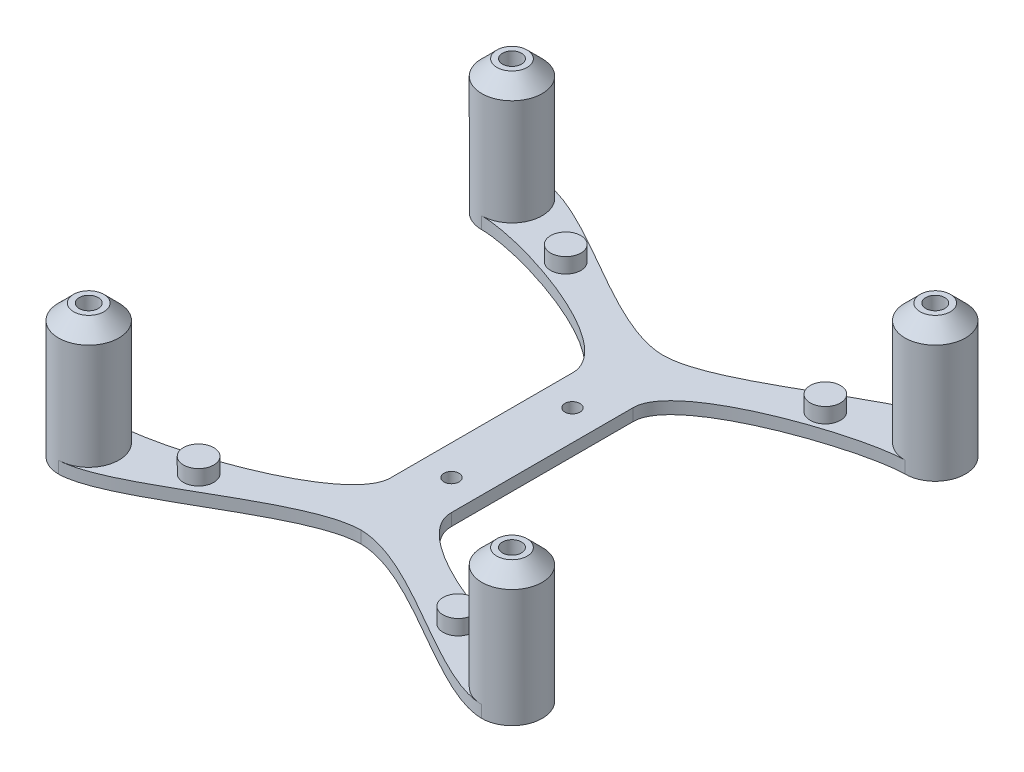
from build123d import *

# Parameters (mm, degrees)
BOSS_EXTRUDE1_DEPTH                        = 2.54
SKETCH2_R                                  = 6.350000000000003
BOSS_EXTRUDE2_DEPTH                        = 25.4
MIRROR1_AT_THE_SECOND_PLANE_COPY_1_DEPTH   = 2.54
MIRROR1_AT_THE_SECOND_PLANE_COPY_2_SKETC_R = 6.350000000000003
MIRROR1_AT_THE_SECOND_PLANE_COPY_2_DEPTH   = 25.4
CHAMFER1_SIZE                              = 3.175
SKETCH3_R                                  = 1.5875000000000001
CUT_EXTRUDE1_DEPTH                         = 77.20000013333332
SKETCH4_R                                  = 2.0000000000000036
CUT_EXTRUDE2_DEPTH                         = 4.8
SKETCH5_R                                  = 1.5999999999999974
CUT_EXTRUDE3_DEPTH                         = 76.47674890287736
MIRROR2_AT_THE_SECOND_PLANE_COPY_1_SKETC_R = 2.0000000000000036
MIRROR2_AT_THE_SECOND_PLANE_COPY_1_DEPTH   = 4.8
MIRROR2_AT_THE_SECOND_PLANE_COPY_2_SKETC_R = 1.5999999999999974
MIRROR2_AT_THE_SECOND_PLANE_COPY_2_DEPTH   = 76.47674890287736
SKETCH6_R                                  = 3.1750000000000003
BOSS_EXTRUDE3_DEPTH                        = 3.175
MIRROR3_AT_THE_SECOND_PLANE_COPY_1_SKETC_R = 3.1750000000000003
MIRROR3_AT_THE_SECOND_PLANE_COPY_1_DEPTH   = 3.175


with BuildPart() as part:
    # Sketch1 → Boss-Extrude1 (new body)
    with BuildSketch(Plane(origin=(0, 0, 0), x_dir=(1, 0, 0), z_dir=(0, 1, 0))):
        with BuildLine():
            Line((-6.35, -7.8e-16), (0, 0))
            Line((0, 0), (0, 31.75))
            add(Edge.make_bspline(
                [(0, 31.75), (-11.810067101614626, 31.826488984199244), (-33.56352785361864, 50.29624659174145), (-44.09723296316762, 50.79019364197376)],
                knots=[0, 0, 0, 0, 0.9888261705717568, 0.9888261705717568, 0.9888261705717568, 0.9888261705717568], degree=3))
            ThreePointArc((-44.09723296316761, 50.79019364197375), (-39.836835647633734, 48.81362402803646), (-38.099999999999994, 44.44999999999999))
            ThreePointArc((-38.099999999999994, 44.44999999999999), (-39.959871939465415, 39.95987193946541), (-44.449999999999996, 38.09999999999999))
            add(Edge.make_bspline(
                [(-6.35, 19.05), (-6.175250797111612, 28.394037165914764), (-35.10270017916649, 38.03721238456326), (-44.449999999999996, 38.09999999999999)],
                knots=[0, 0, 0, 0, 1, 1, 1, 1], degree=3))
            Line((-6.35, 19.05), (-6.35, -7.8e-16))
        make_face()
        with BuildLine():
            add(Edge.make_bspline(
                [(-44.09723296316762, 50.79019364197376), (-44.216264829075314, 50.79577529044761), (-44.333864020357055, 50.79906156917483), (-44.45000000000001, 50.79999999999999)],
                knots=[0.9888261705717568, 0.9888261705717568, 0.9888261705717568, 0.9888261705717568, 1, 1, 1, 1], degree=3))
            ThreePointArc((-44.09723296316761, 50.79019364197375), (-44.27354834448691, 50.79754793705936), (-44.45000000000001, 50.79999999999999))
        make_face()
        with BuildLine():
            ThreePointArc((-38.099999999999994, 44.44999999999999), (-39.836835647633734, 48.81362402803646), (-44.09723296316761, 50.79019364197375))
            add(Edge.make_bspline(
                [(-44.09723296316762, 50.79019364197376), (-44.216264829075314, 50.79577529044761), (-44.333864020357055, 50.79906156917483), (-44.45000000000001, 50.79999999999999)],
                knots=[0.9888261705717568, 0.9888261705717568, 0.9888261705717568, 0.9888261705717568, 1, 1, 1, 1], degree=3))
            ThreePointArc((-44.45000000000001, 50.79999999999999), (-50.8, 44.44999999999998), (-44.449999999999996, 38.09999999999999))
            ThreePointArc((-44.449999999999996, 38.09999999999999), (-39.959871939465415, 39.95987193946541), (-38.099999999999994, 44.44999999999999))
        make_face()
    boss_extrude1 = extrude(amount=BOSS_EXTRUDE1_DEPTH)

    # Sketch2 → Boss-Extrude2 (add)
    with BuildSketch(Plane(origin=(0, 2.54, 0), x_dir=(1, 0, 0), z_dir=(0, 1, 0))):
        with Locations(Location((-44.449999999999996, 44.44999999999999, 0), (0, 0, 270))):
            Circle(SKETCH2_R)
    boss_extrude2 = extrude(amount=BOSS_EXTRUDE2_DEPTH)

    # Mirror1: Boss-Extrude1, Boss-Extrude2 across plane
    add(boss_extrude1.mirror(Plane(origin=(0, 0, 0), x_dir=(0, 0, 1), z_dir=(1, 0, 0))))
    add(boss_extrude2.mirror(Plane(origin=(0, 0, 0), x_dir=(0, 0, 1), z_dir=(1, 0, 0))))

    # Mirror1 at the second plane: Boss-Extrude1, Boss-Extrude2 across plane
    add(boss_extrude1.mirror(Plane.XY))
    add(boss_extrude2.mirror(Plane.XY))

    # Mirror1 at the second plane copy 1 sketc → Mirror1 at the second plane copy 1 (add)
    with BuildSketch(Plane(origin=(0, 0, 0), x_dir=(-1, 0, 0), z_dir=(0, 1, 0))):
        with BuildLine():
            Line((-6.35, -7.8e-16), (0, 0))
            Line((0, 0), (0, 31.75))
            add(Edge.make_bspline(
                [(0, 31.75), (-11.810067101614626, 31.826488984199244), (-33.56352785361864, 50.29624659174145), (-44.09723296316762, 50.79019364197376)],
                knots=[0, 0, 0, 0, 0.9888261705717568, 0.9888261705717568, 0.9888261705717568, 0.9888261705717568], degree=3))
            ThreePointArc((-44.09723296316761, 50.79019364197375), (-39.836835647633734, 48.81362402803646), (-38.099999999999994, 44.44999999999999))
            ThreePointArc((-38.099999999999994, 44.44999999999999), (-39.959871939465415, 39.95987193946541), (-44.449999999999996, 38.09999999999999))
            add(Edge.make_bspline(
                [(-6.35, 19.05), (-6.175250797111612, 28.394037165914764), (-35.10270017916649, 38.03721238456326), (-44.449999999999996, 38.09999999999999)],
                knots=[0, 0, 0, 0, 1, 1, 1, 1], degree=3))
            Line((-6.35, 19.05), (-6.35, -7.8e-16))
        make_face()
        with BuildLine():
            add(Edge.make_bspline(
                [(-44.09723296316762, 50.79019364197376), (-44.216264829075314, 50.79577529044761), (-44.333864020357055, 50.79906156917483), (-44.45000000000001, 50.79999999999999)],
                knots=[0.9888261705717568, 0.9888261705717568, 0.9888261705717568, 0.9888261705717568, 1, 1, 1, 1], degree=3))
            ThreePointArc((-44.09723296316761, 50.79019364197375), (-44.27354834448691, 50.79754793705936), (-44.45000000000001, 50.79999999999999))
        make_face()
        with BuildLine():
            ThreePointArc((-38.099999999999994, 44.44999999999999), (-39.836835647633734, 48.81362402803646), (-44.09723296316761, 50.79019364197375))
            add(Edge.make_bspline(
                [(-44.09723296316762, 50.79019364197376), (-44.216264829075314, 50.79577529044761), (-44.333864020357055, 50.79906156917483), (-44.45000000000001, 50.79999999999999)],
                knots=[0.9888261705717568, 0.9888261705717568, 0.9888261705717568, 0.9888261705717568, 1, 1, 1, 1], degree=3))
            ThreePointArc((-44.45000000000001, 50.79999999999999), (-50.8, 44.44999999999998), (-44.449999999999996, 38.09999999999999))
            ThreePointArc((-44.449999999999996, 38.09999999999999), (-39.959871939465415, 39.95987193946541), (-38.099999999999994, 44.44999999999999))
        make_face()
    extrude(amount=MIRROR1_AT_THE_SECOND_PLANE_COPY_1_DEPTH)

    # Mirror1 at the second plane copy 2 sketc → Mirror1 at the second plane copy 2 (add)
    with BuildSketch(Plane(origin=(0, 2.54, 0), x_dir=(-1, 0, 0), z_dir=(0, 1, 0))):
        with Locations(Location((-44.449999999999996, 44.44999999999999, 0), (0, 0, 270))):
            Circle(MIRROR1_AT_THE_SECOND_PLANE_COPY_2_SKETC_R)
    extrude(amount=MIRROR1_AT_THE_SECOND_PLANE_COPY_2_DEPTH)

    # Chamfer1
    chamfer1_edges = [part.edges().sort_by_distance(p)[0] for p in [
        (-44.449999999999996, 27.939999999999998, -50.79999999999999),
        (-44.449999999999996, 27.939999999999998, 50.79999999999999),
        (44.449999999999996, 27.939999999999998, -50.79999999999999),
        (44.449999999999996, 27.939999999999998, 50.79999999999999),
    ]]
    chamfer(chamfer1_edges, length=CHAMFER1_SIZE)

    # Sketch3 → Cut-Extrude1 (cut, through all)
    with BuildSketch(Plane(origin=(0, 2.54, 0), x_dir=(1, 0, 0), z_dir=(0, 1, 0))):
        with Locations(Location((0, 12.7, 0), (0, 0, 270))):
            Circle(SKETCH3_R)
        with Locations(Location((0, -12.7, 0), (0, 0, 270))):
            Circle(SKETCH3_R)
    extrude(amount=-CUT_EXTRUDE1_DEPTH, mode=Mode.SUBTRACT)

    # Sketch4 → Cut-Extrude2 (cut)
    with BuildSketch(Plane(origin=(0, 27.94, 0), x_dir=(1, 0, 0), z_dir=(0, 1, 0))):
        with Locations(Location((-44.449999999999996, 44.44999999999999, 0), (0, 0, 270))):
            Circle(SKETCH4_R)
    cut_extrude2 = extrude(amount=-CUT_EXTRUDE2_DEPTH, mode=Mode.SUBTRACT)

    # Sketch5 → Cut-Extrude3 (cut, through all)
    with BuildSketch(Plane(origin=(0, 23.14, 0), x_dir=(1, 0, 0), z_dir=(0, 1, 0))):
        with Locations(Location((-44.449999999999996, 44.44999999999999, 0), (0, 0, 270))):
            Circle(SKETCH5_R)
    cut_extrude3 = extrude(amount=-CUT_EXTRUDE3_DEPTH, mode=Mode.SUBTRACT)

    # Mirror2: Cut-Extrude2, Cut-Extrude3 across plane
    add(cut_extrude2.mirror(Plane(origin=(0, 0, 0), x_dir=(0, 0, 1), z_dir=(1, 0, 0))), mode=Mode.SUBTRACT)
    add(cut_extrude3.mirror(Plane(origin=(0, 0, 0), x_dir=(0, 0, 1), z_dir=(1, 0, 0))), mode=Mode.SUBTRACT)

    # Mirror2 at the second plane: Cut-Extrude2, Cut-Extrude3 across plane
    add(cut_extrude2.mirror(Plane.XY), mode=Mode.SUBTRACT)
    add(cut_extrude3.mirror(Plane.XY), mode=Mode.SUBTRACT)

    # Mirror2 at the second plane copy 1 sketc → Mirror2 at the second plane copy 1 (cut)
    with BuildSketch(Plane(origin=(0, 27.94, 0), x_dir=(-1, 0, 0), z_dir=(0, 1, 0))):
        with Locations(Location((-44.449999999999996, 44.44999999999999, 0), (0, 0, 270))):
            Circle(MIRROR2_AT_THE_SECOND_PLANE_COPY_1_SKETC_R)
    extrude(amount=-MIRROR2_AT_THE_SECOND_PLANE_COPY_1_DEPTH, mode=Mode.SUBTRACT)

    # Mirror2 at the second plane copy 2 sketc → Mirror2 at the second plane copy 2 (cut, through all)
    with BuildSketch(Plane(origin=(0, 23.14, 0), x_dir=(-1, 0, 0), z_dir=(0, 1, 0))):
        with Locations(Location((-44.449999999999996, 44.44999999999999, 0), (0, 0, 270))):
            Circle(MIRROR2_AT_THE_SECOND_PLANE_COPY_2_SKETC_R)
    extrude(amount=-MIRROR2_AT_THE_SECOND_PLANE_COPY_2_DEPTH, mode=Mode.SUBTRACT)

    # Sketch6 → Boss-Extrude3 (add)
    with BuildSketch(Plane(origin=(0, 2.54, 0), x_dir=(1, 0, 0), z_dir=(0, 1, 0))):
        with Locations(Location((-27.261721515519312, 38.55656577331098, 0), (0, 0, 270))):
            Circle(SKETCH6_R)
    boss_extrude3 = extrude(amount=BOSS_EXTRUDE3_DEPTH)

    # Mirror3: Boss-Extrude3 across plane
    add(boss_extrude3.mirror(Plane(origin=(0, 0, 0), x_dir=(0, 0, 1), z_dir=(1, 0, 0))))

    # Mirror3 at the second plane: Boss-Extrude3 across plane
    add(boss_extrude3.mirror(Plane.XY))

    # Mirror3 at the second plane copy 1 sketc → Mirror3 at the second plane copy 1 (add)
    with BuildSketch(Plane(origin=(0, 2.54, 0), x_dir=(-1, 0, 0), z_dir=(0, 1, 0))):
        with Locations(Location((-27.261721515519312, 38.55656577331098, 0), (0, 0, 270))):
            Circle(MIRROR3_AT_THE_SECOND_PLANE_COPY_1_SKETC_R)
    extrude(amount=MIRROR3_AT_THE_SECOND_PLANE_COPY_1_DEPTH)


solid = part.part
